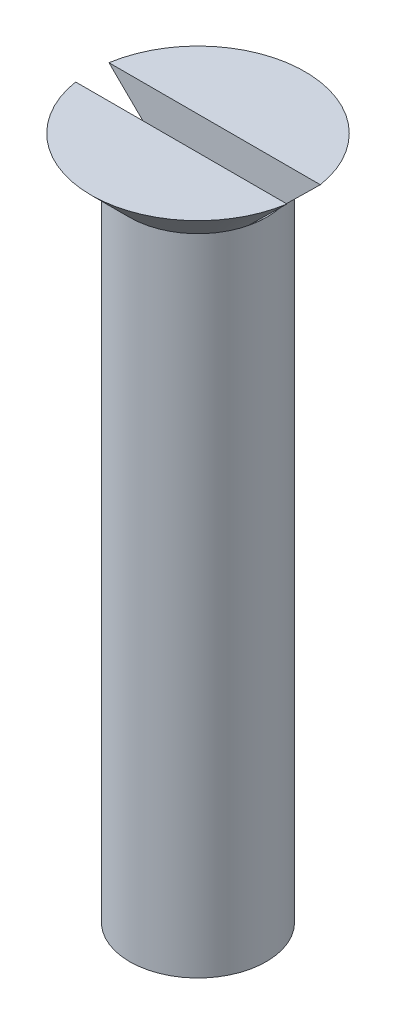
from build123d import *

# Parameters (mm, degrees)
CUT_EXTRUDE1_DEPTH      = 15.320258557
CUT_EXTRUDE1_DEPTH_BACK = 15.320258557
SKETCH2_W               = 1.219880404
SKETCH2_H               = 2.734998975


with BuildPart() as part:
    # Sketch1 → Revolve1 (revolve)
    with BuildSketch(Plane.XY, mode=Mode.PRIVATE) as revolve1_sk:
        Polygon((0, 13.207106781), (-3.914213562, 13.207106781), (-2.5, 11.792893219), (-2.5, -11.792893219), (0, -11.792893219), align=None)
    revolve(revolve1_sk.sketch.rotate(Axis((0, 14.992211838, 0), (0, -1, 0)), 270), axis=Axis((0, 14.992211838, 0), (0, -1, 0)))

    # Sketch2 → Cut-Extrude1 (cut, two sides: drawn at the far end of the back side and taken through both)
    with BuildSketch(Plane(origin=(0, 0, 0), x_dir=(0, 0, -1), z_dir=(1, 0, 0)).offset(-CUT_EXTRUDE1_DEPTH_BACK)):
        with Locations((0, 13.207106782)):
            Rectangle(SKETCH2_W, SKETCH2_H)
    extrude(amount=CUT_EXTRUDE1_DEPTH + CUT_EXTRUDE1_DEPTH_BACK, mode=Mode.SUBTRACT)


solid = part.part
